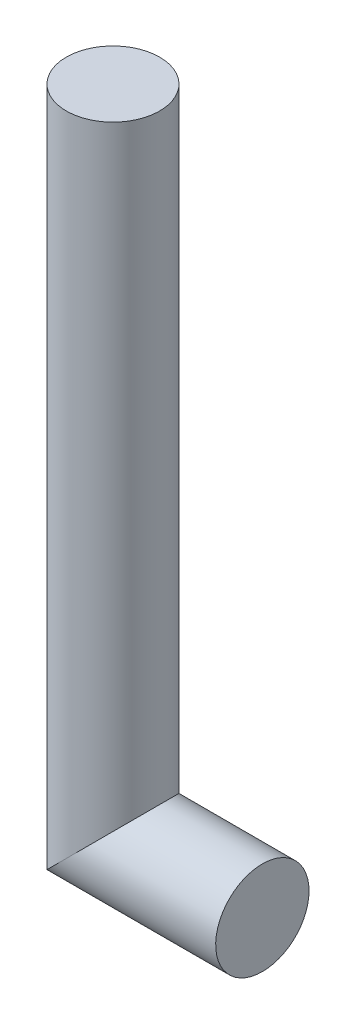
from build123d import *

# Parameters (mm, degrees)
SWEEP2_PROFILE_R = 37.5
MOVE_FACE1_BY    = 100
MOVE_FACE2_BY    = 120


with BuildPart() as part:
    # Sweep2: sweep along a path in Sketch1
    with BuildLine(Plane.XY) as sweep2_path:
        Line((120, 0), (0, 0))
        Line((0, 0), (0, 300))
    # Sweep2 profile (on start of the path) → Sweep2 (sweep)
    with BuildSketch(Plane(origin=(120, 0, 0), x_dir=(0, -1, 0), z_dir=(-1, 0, 0))):
        Circle(SWEEP2_PROFILE_R)
    sweep(path=sweep2_path.line, transition=Transition.RIGHT)

    # Move Face1: a face moved outward by 100.0
    extrude(part.faces().sort_by_distance((0, 300, 0))[0], amount=MOVE_FACE1_BY, dir=(0, 1, 0))

    # Move Face2: a face moved outward by 120.0
    extrude(part.faces().sort_by_distance((0, 400, 0))[0], amount=MOVE_FACE2_BY, dir=(0, 1, 0))


solid = part.part
